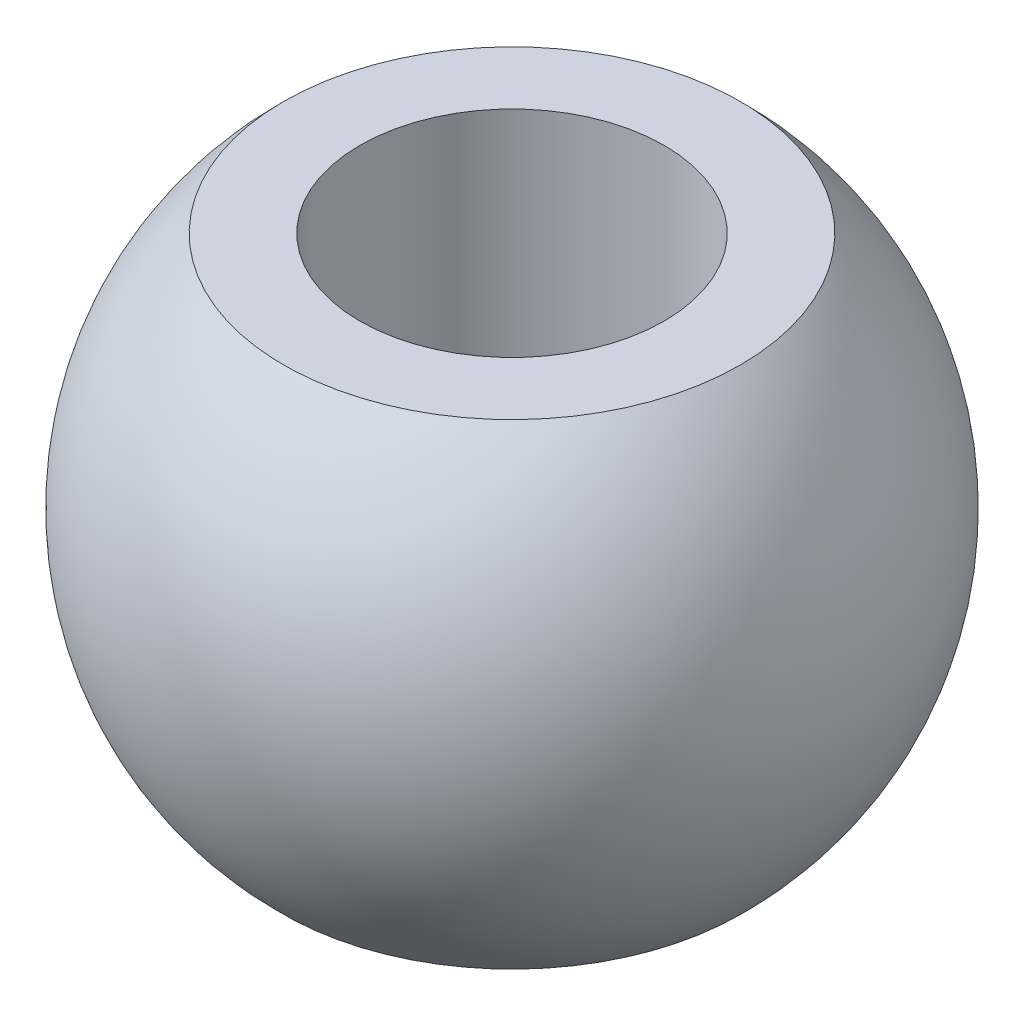
from build123d import *

# Parameters (mm, degrees)
SKETCH_2_R          = 3
CUT_EXTRUDE_1_DEPTH = 14.133925537


with BuildPart() as part:
    # 草图1 → 旋转2 (revolve)
    with BuildSketch(Plane.XY):
        with BuildLine():
            Line((0, 4.69041576), (4.5, 4.69041576))
            ThreePointArc((4.5, 4.69041576), (6.5, 0), (4.5, -4.69041576))
            Line((4.5, -4.69041576), (0, -4.69041576))
            Line((0, -4.69041576), (0, 4.69041576))
        make_face()
    revolve(axis=Axis((0, 4.69041576, 0), (0, -1, 0)))

    # 草图2 → 切除-拉伸1 (cut, through all)
    with BuildSketch(Plane(origin=(0, 4.69041576, 0), x_dir=(1, 0, 0), z_dir=(0, 1, 0))):
        with Locations(Location((0, 0, 0), (0, 0, 180))):
            Circle(SKETCH_2_R)
    extrude(amount=-CUT_EXTRUDE_1_DEPTH, mode=Mode.SUBTRACT)


solid = part.part
